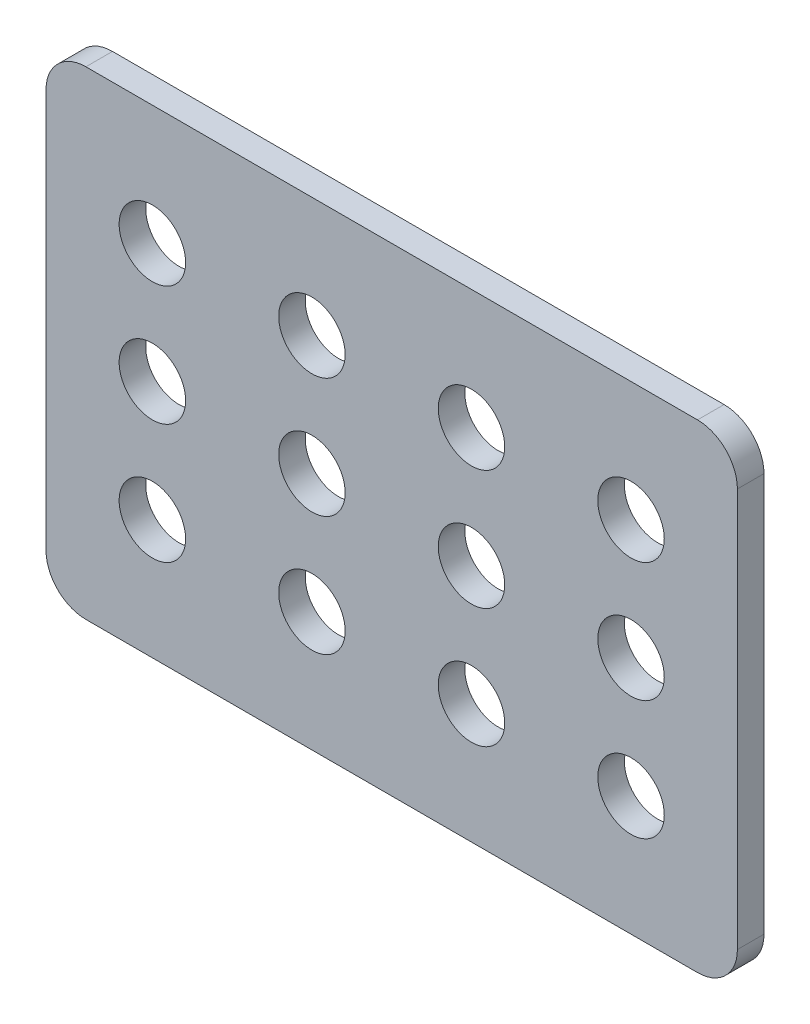
from build123d import *

# Parameters (mm, degrees)
SZKIC1_R                    = 12.5
DODANIE_WYCI_GNI_CIE1_DEPTH = 10


with BuildPart() as part:
    # Szkic1 → Dodanie-wyciągnięcie1 (new body)
    with BuildSketch(Plane.XY):
        with BuildLine():
            Line((15, 0), (245, 0))
            ThreePointArc((245, 0), (255.606601718, 4.393398282), (260, 15))
            Line((260, 15), (260, 165))
            ThreePointArc((260, 165), (255.606601718, 175.606601718), (245, 180))
            Line((245, 180), (15, 180))
            ThreePointArc((15, 180), (4.393398282, 175.606601718), (0, 165))
            Line((0, 165), (0, 15))
            ThreePointArc((0, 15), (4.393398282, 4.393398282), (15, 0))
        make_face()
        with Locations((40, 45)):
            Circle(SZKIC1_R, mode=Mode.SUBTRACT)
        with Locations((100, 45)):
            Circle(SZKIC1_R, mode=Mode.SUBTRACT)
        with Locations((160, 45)):
            Circle(SZKIC1_R, mode=Mode.SUBTRACT)
        with Locations((220, 45)):
            Circle(SZKIC1_R, mode=Mode.SUBTRACT)
        with Locations((100, 90)):
            Circle(SZKIC1_R, mode=Mode.SUBTRACT)
        with Locations((160, 90)):
            Circle(SZKIC1_R, mode=Mode.SUBTRACT)
        with Locations((220, 90)):
            Circle(SZKIC1_R, mode=Mode.SUBTRACT)
        with Locations((100, 135)):
            Circle(SZKIC1_R, mode=Mode.SUBTRACT)
        with Locations((160, 135)):
            Circle(SZKIC1_R, mode=Mode.SUBTRACT)
        with Locations((220, 135)):
            Circle(SZKIC1_R, mode=Mode.SUBTRACT)
        with Locations((40, 90)):
            Circle(SZKIC1_R, mode=Mode.SUBTRACT)
        with Locations((40, 135)):
            Circle(SZKIC1_R, mode=Mode.SUBTRACT)
    extrude(amount=DODANIE_WYCI_GNI_CIE1_DEPTH)


solid = part.part
